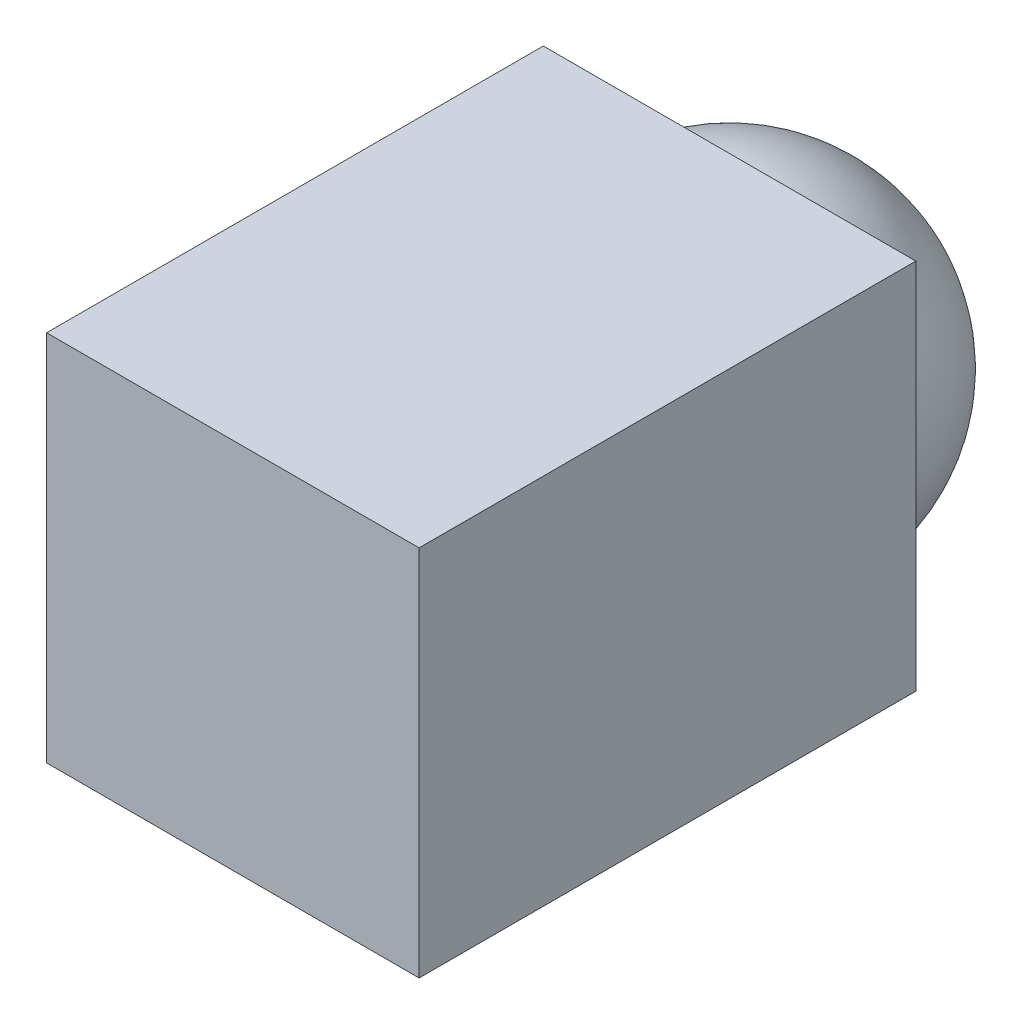
from build123d import *

# Parameters (mm, degrees)
SKETCH1_W           = 15
SKETCH1_H           = 15
BOSS_EXTRUDE1_DEPTH = 20
REVOLVE1_ANGLE      = 180


with BuildPart() as part:
    # Sketch1 → Boss-Extrude1 (new body)
    with BuildSketch(Plane.XY):
        with Locations((7.5, -7.5)):
            Rectangle(SKETCH1_W, SKETCH1_H)
    extrude(amount=BOSS_EXTRUDE1_DEPTH)

    # Sketch2 → Revolve1 (revolve)
    with BuildSketch(Plane(origin=(0, 0, 0), x_dir=(-1, 0, 0), z_dir=(0, 0, -1))):
        with BuildLine():
            Line((-14.5, -7.5), (-0.5, -7.5))
            ThreePointArc((-0.5, -7.5), (-7.5, -14.5), (-14.5, -7.5))
        make_face()
    revolve(axis=Axis((14.5, -7.5, 0), (1, 0, 0)), revolution_arc=REVOLVE1_ANGLE)


solid = part.part
